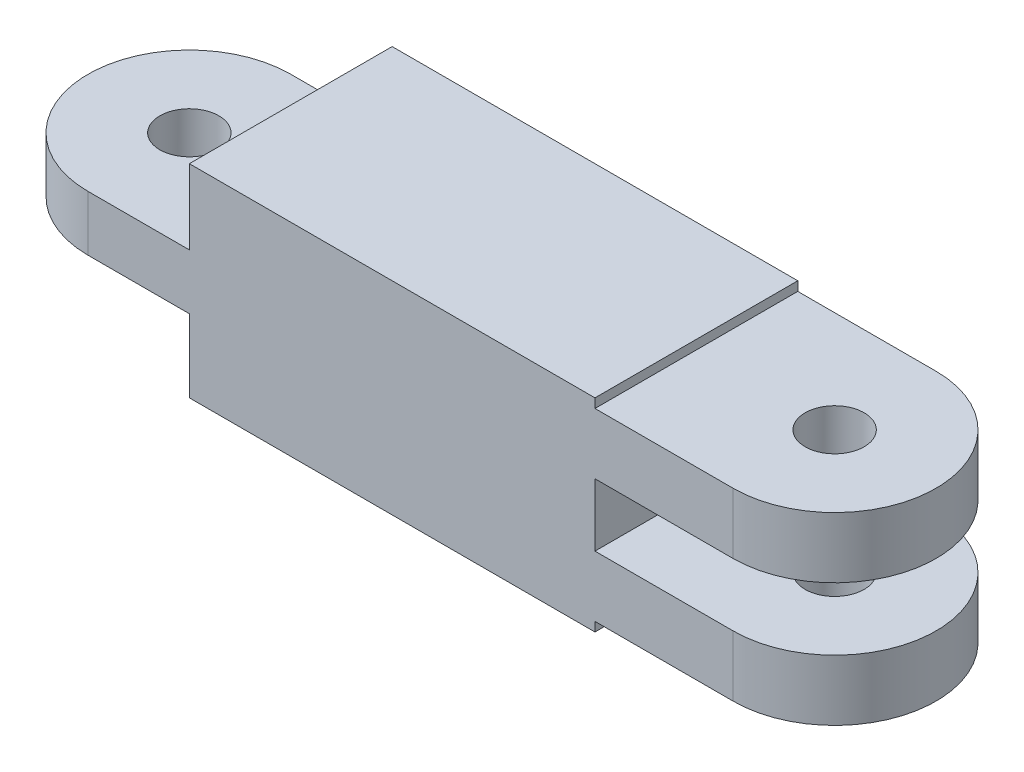
from build123d import *

# Parameters (mm, degrees)
CROQUIS2_W              = 22
CROQUIS2_H              = 11
SALIENTE_EXTRUIR1_DEPTH = 11
CROQUIS4_W              = 13
CROQUIS4_H              = 3.3
CROQUIS4_W_2            = 11
CROQUIS4_H_2            = 3
SALIENTE_EXTRUIR2_DEPTH = 11
REDONDEO1_RADIUS        = 5.5
REDONDEO1_LENGTH        = 3
REDONDEO2_RADIUS        = 5.5
REDONDEO2_LENGTH        = 3.3
REDONDEO3_RADIUS        = 5.5
REDONDEO3_LENGTH        = 3.3
CROQUIS7_R              = 1.6
CORTAR_EXTRUIR3_DEPTH   = 27.428025294
CROQUIS8_R              = 1.6
CORTAR_EXTRUIR4_DEPTH   = 28.575134105


with BuildPart() as part:
    # Croquis2 → Saliente-Extruir1 (new body)
    with BuildSketch(Plane.XY):
        with Locations((-0.996999741, -40.458999634)):
            Rectangle(CROQUIS2_W, CROQUIS2_H)
    extrude(amount=SALIENTE_EXTRUIR1_DEPTH)

    # Croquis4 → Saliente-Extruir2 (add)
    with BuildSketch(Plane.XY.offset(11)):
        with Locations((16.503000259, -43.808999634)):
            Rectangle(CROQUIS4_W, CROQUIS4_H)
        with Locations((-17.496999741, -40.508999634)):
            Rectangle(CROQUIS4_W_2, CROQUIS4_H_2)
        with Locations((16.503000259, -37.108999634)):
            Rectangle(CROQUIS4_W, CROQUIS4_H)
    extrude(amount=-SALIENTE_EXTRUIR2_DEPTH)

    # Redondeo1: full round fillet: the end face becomes a half cylinder, R = half its width
    redondeo1_face = Plane((-22.996999741, -40.508999634, 5.5), x_dir=(0, -1, 0), z_dir=(-1, 0, 0))  # on the end face: x along it, z out of the body
    redondeo1_slab = redondeo1_face.offset(-REDONDEO1_RADIUS / 2) * Box(REDONDEO1_LENGTH, 2 * REDONDEO1_RADIUS, REDONDEO1_RADIUS, mode=Mode.PRIVATE)  # the body's end, R deep
    redondeo1_round = Plane((-17.496999741, -40.508999634, 5.5), x_dir=(-1, 0, 0), z_dir=(0, -1, 0)) * Cylinder(REDONDEO1_RADIUS, REDONDEO1_LENGTH, mode=Mode.PRIVATE)  # its axis R under the face
    add(redondeo1_slab - redondeo1_round, mode=Mode.SUBTRACT)

    # Redondeo2: full round fillet: the end face becomes a half cylinder, R = half its width
    redondeo2_face = Plane((23.003000259, -37.108999634, 5.5), x_dir=(0, 1, 0), z_dir=(1, 0, 0))  # on the end face: x along it, z out of the body
    redondeo2_slab = redondeo2_face.offset(-REDONDEO2_RADIUS / 2) * Box(REDONDEO2_LENGTH, 2 * REDONDEO2_RADIUS, REDONDEO2_RADIUS, mode=Mode.PRIVATE)  # the body's end, R deep
    redondeo2_round = Plane((17.503000259, -37.108999634, 5.5), x_dir=(1, 0, 0), z_dir=(0, 1, 0)) * Cylinder(REDONDEO2_RADIUS, REDONDEO2_LENGTH, mode=Mode.PRIVATE)  # its axis R under the face
    add(redondeo2_slab - redondeo2_round, mode=Mode.SUBTRACT)

    # Redondeo3: full round fillet: the end face becomes a half cylinder, R = half its width
    redondeo3_face = Plane((23.003000259, -43.808999634, 5.5), x_dir=(0, 1, 0), z_dir=(1, 0, 0))  # on the end face: x along it, z out of the body
    redondeo3_slab = redondeo3_face.offset(-REDONDEO3_RADIUS / 2) * Box(REDONDEO3_LENGTH, 2 * REDONDEO3_RADIUS, REDONDEO3_RADIUS, mode=Mode.PRIVATE)  # the body's end, R deep
    redondeo3_round = Plane((17.503000259, -43.808999634, 5.5), x_dir=(1, 0, 0), z_dir=(0, 1, 0)) * Cylinder(REDONDEO3_RADIUS, REDONDEO3_LENGTH, mode=Mode.PRIVATE)  # its axis R under the face
    add(redondeo3_slab - redondeo3_round, mode=Mode.SUBTRACT)

    # Croquis7 → Cortar-Extruir3 (cut, through all)
    with BuildSketch(Plane(origin=(0, -39.008999634, 0), x_dir=(1, 0, 0), z_dir=(0, 1, 0))):
        with Locations(Location((-17.496999741, -5.5, 0), (0, 0, 270))):
            Circle(CROQUIS7_R)
    extrude(amount=-CORTAR_EXTRUIR3_DEPTH, mode=Mode.SUBTRACT)

    # Croquis8 → Cortar-Extruir4 (cut, through all)
    with BuildSketch(Plane(origin=(0, -35.458999634, 0), x_dir=(1, 0, 0), z_dir=(0, 1, 0))):
        with Locations(Location((17.503000259, -5.5, 0), (0, 0, 270))):
            Circle(CROQUIS8_R)
    extrude(amount=-CORTAR_EXTRUIR4_DEPTH, mode=Mode.SUBTRACT)


solid = part.part
